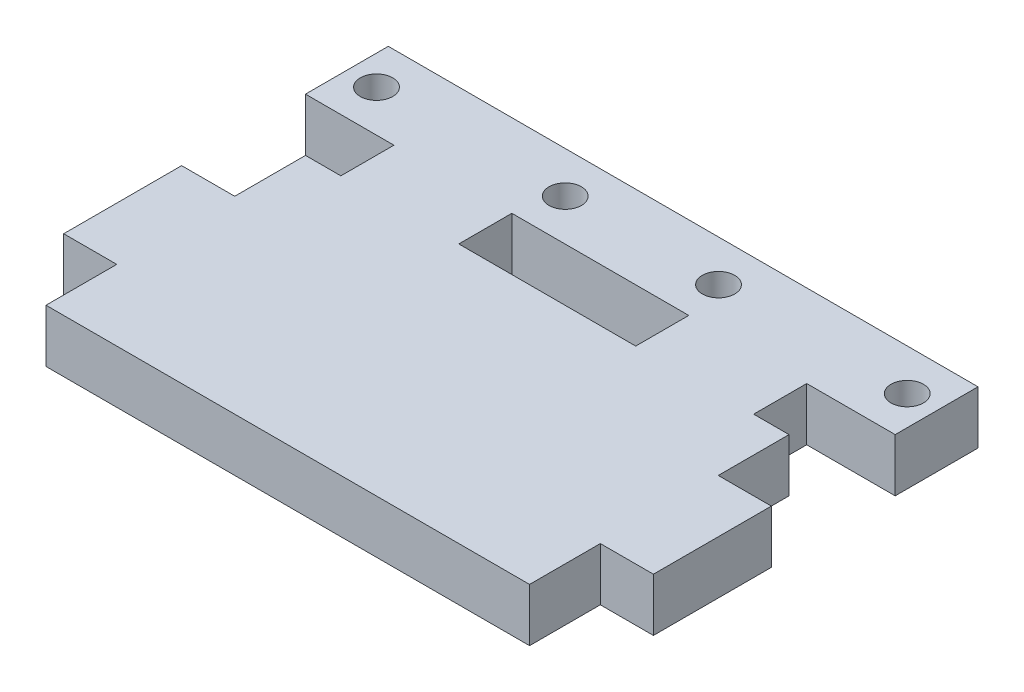
from build123d import *

# Parameters (mm, degrees)
SKETCH1_W           = 30
SKETCH1_H           = 9
BOSS_EXTRUDE1_DEPTH = 9
SKETCH3_R           = 2.75
CUT_EXTRUDE1_DEPTH  = 113.202955527


with BuildPart() as part:
    # Sketch1 → Boss-Extrude1 (new body)
    with BuildSketch(Plane(origin=(0, 0, 0), x_dir=(1, 0, 0), z_dir=(0, 1, 0))):
        Polygon((50, -88.042507111), (50, -68.042507111), (41, -68.042507111), (41, -56.042507111), (35, -56.042507111), (35, -47.042507111), (50, -47.042507111), (50, -33), (-50, -33), (-50, -47.042507111), (-35, -47.042507111), (-35, -56.042507111), (-41, -56.042507111), (-41, -68.042507111), (-50, -68.042507111), (-50, -88.042507111), (-41, -88.042507111), (-41, -100.042507111), (41, -100.042507111), (41, -88.042507111), align=None)
        with Locations((0, -51.542507111)):
            Rectangle(SKETCH1_W, SKETCH1_H, mode=Mode.SUBTRACT)
    extrude(amount=BOSS_EXTRUDE1_DEPTH)

    # Sketch3 → Cut-Extrude1 (cut, through all)
    with BuildSketch(Plane(origin=(0, 9, 0), x_dir=(1, 0, 0), z_dir=(0, 1, 0))):
        with Locations(Location((-45, -40, 0), (0, 0, 270))):
            Circle(SKETCH3_R)
        with Locations(Location((-13, -40, 0), (0, 0, 270))):
            Circle(SKETCH3_R)
        with Locations(Location((13, -40, 0), (0, 0, 90))):
            Circle(SKETCH3_R)
        with Locations(Location((45, -40, 0), (0, 0, 90))):
            Circle(SKETCH3_R)
    extrude(amount=-CUT_EXTRUDE1_DEPTH, mode=Mode.SUBTRACT)


solid = part.part
